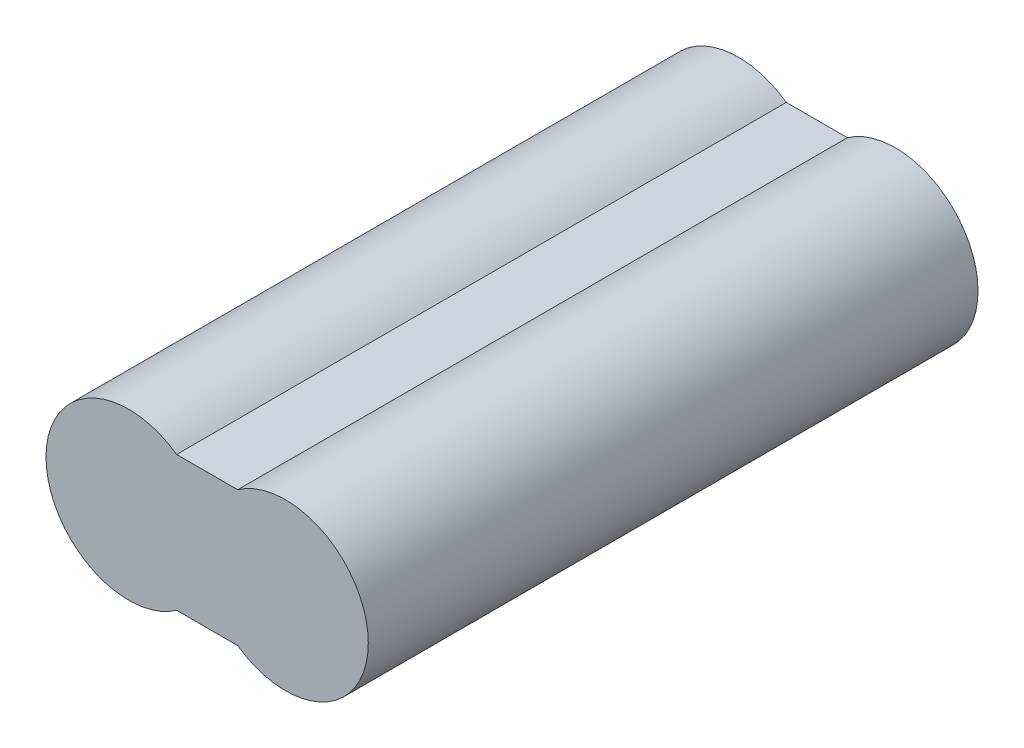
from build123d import *

# Parameters (mm, degrees)
BOSS_EXTRUDE1_DEPTH = 70
SKETCH2_W           = 7.011369512
SKETCH2_H           = 15.5
BOSS_EXTRUDE2_DEPTH = 70


with BuildPart() as part:
    # Sketch1 → Boss-Extrude1 (new body)
    with BuildSketch(Plane.XY):
        with BuildLine():
            ThreePointArc((9, 3.041381265), (-9.5, 0), (9, -3.041381265))
            ThreePointArc((9, -3.041381265), (27.5, 0), (9, 3.041381265))
        make_face()
    extrude(amount=-BOSS_EXTRUDE1_DEPTH)

    # Sketch2 → Boss-Extrude2 (add)
    with BuildSketch(Plane.XY):
        with Locations((9, 0)):
            Rectangle(SKETCH2_W, SKETCH2_H)
    extrude(amount=-BOSS_EXTRUDE2_DEPTH)


solid = part.part
